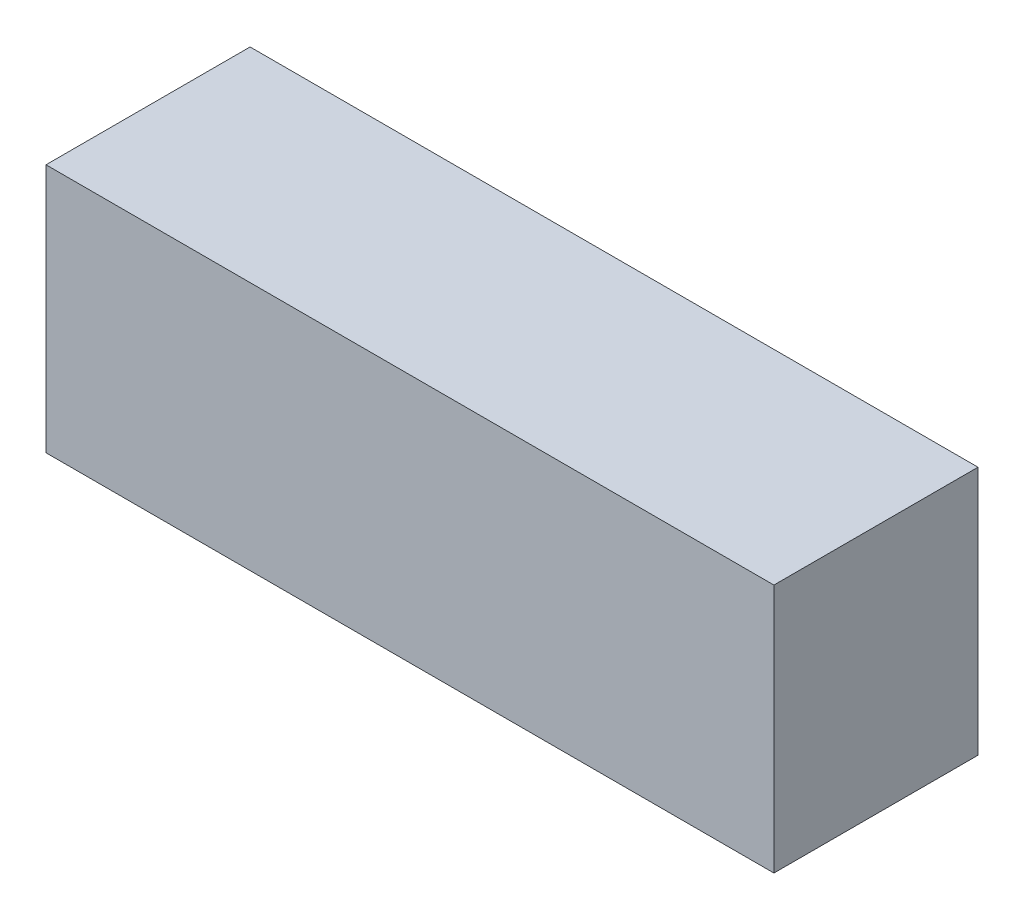
from build123d import *

# Parameters (mm, degrees)
SKETCH1_W           = 64.2
SKETCH1_H           = 22
BOSS_EXTRUDE1_DEPTH = 18


with BuildPart() as part:
    # Sketch1 → Boss-Extrude1 (new body)
    with BuildSketch(Plane.XY):
        with Locations((7.913664596, -0.819875776)):
            Rectangle(SKETCH1_W, SKETCH1_H)
    extrude(amount=BOSS_EXTRUDE1_DEPTH)


solid = part.part
